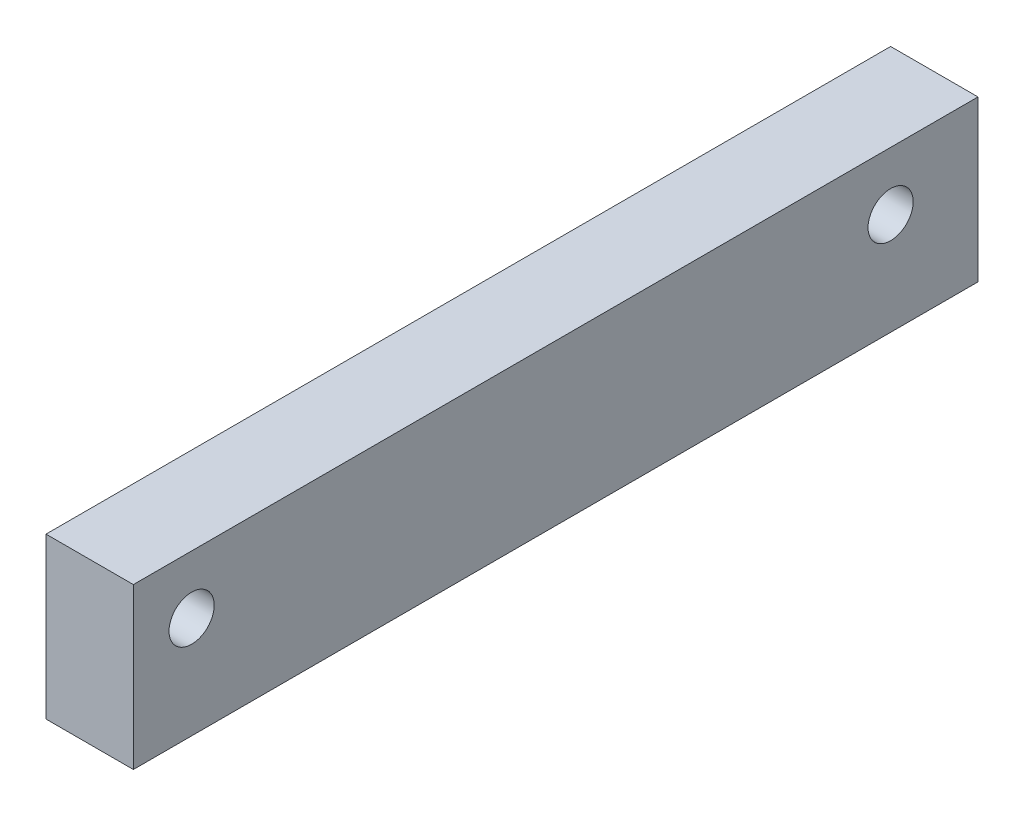
from build123d import *

# Parameters (mm, degrees)
SZKIC1_W                    = 58
SZKIC1_H                    = 11
SZKIC1_R                    = 1.55
DODANIE_WYCI_GNI_CIE1_DEPTH = 6


with BuildPart() as part:
    # Szkic1 → Dodanie-wyciągnięcie1 (new body)
    with BuildSketch(Plane.ZY):
        with Locations((-846, 35.19227062)):
            Rectangle(SZKIC1_W, SZKIC1_H)
        with Locations((-869, 36.69227062)):
            Circle(SZKIC1_R, mode=Mode.SUBTRACT)
        with Locations((-821, 36.69227062)):
            Circle(SZKIC1_R, mode=Mode.SUBTRACT)
    extrude(amount=DODANIE_WYCI_GNI_CIE1_DEPTH)


solid = part.part
